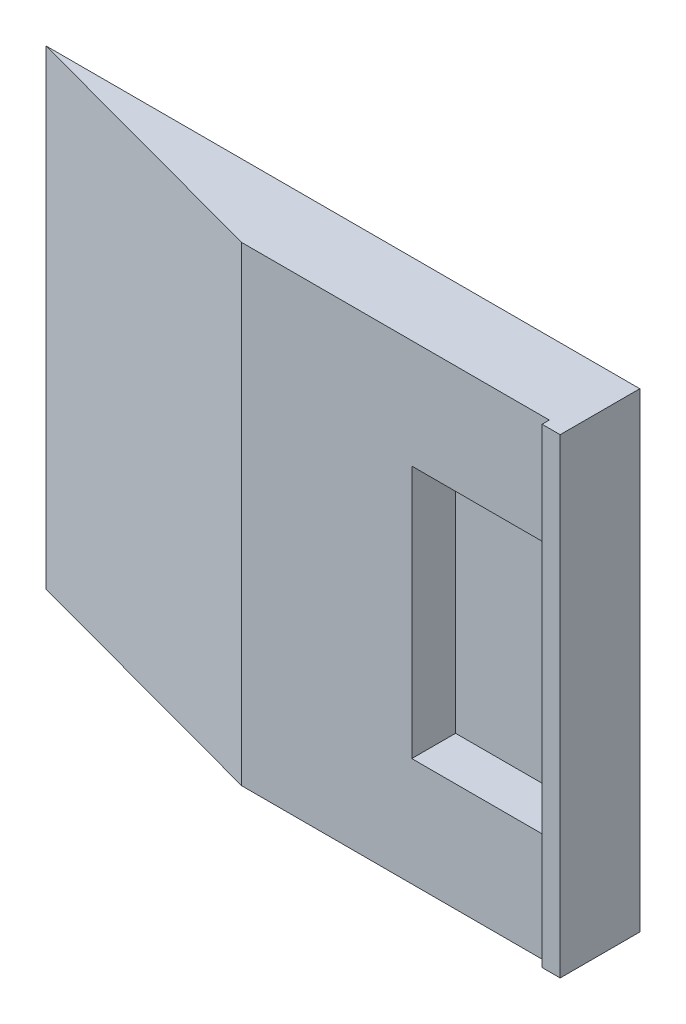
from build123d import *

# Parameters (mm, degrees)
SKETCH1_W           = 190
SKETCH1_H           = 150
BOSS_EXTRUDE1_DEPTH = 60.5
SKETCH3_W           = 60.5
SKETCH3_H           = 150
BOSS_EXTRUDE2_DEPTH = 25
SKETCH4_W           = 450
SKETCH4_H           = 650
BOSS_EXTRUDE3_DEPTH = 39.5
BOSS_EXTRUDE4_DEPTH = 650


with BuildPart() as part:
    # Sketch1 → Boss-Extrude1 (new body)
    with BuildSketch(Plane.XY):
        with Locations((0, 250)):
            Rectangle(SKETCH1_W, SKETCH1_H)
        Polygon((-95, -175), (-95, 175), (-95, 325), (-330, 325), (-330, -325), (95, -325), (95, -175), align=None)
    extrude(amount=BOSS_EXTRUDE1_DEPTH)

    # Sketch3 → Boss-Extrude2 (add)
    with BuildSketch(Plane(origin=(95, 0, 0), x_dir=(0, 0, -1), z_dir=(1, 0, 0))):
        Polygon((-70.5, -325), (0, -325), (0, 175), (-60.5, 175), (-60.5, 325), (-70.5, 325), align=None)
        with Locations((-30.25, 250)):
            Rectangle(SKETCH3_W, SKETCH3_H)
    extrude(amount=BOSS_EXTRUDE2_DEPTH)

    # Sketch4 → Boss-Extrude3 (add)
    with BuildSketch(Plane(origin=(0, 0, 0), x_dir=(-1, 0, 0), z_dir=(0, 0, -1))):
        with Locations((105, 0)):
            Rectangle(SKETCH4_W, SKETCH4_H)
    extrude(amount=BOSS_EXTRUDE3_DEPTH)

    # Sketch8 → Boss-Extrude4 (add)
    with BuildSketch(Plane(origin=(0, 325, 0), x_dir=(1, 0, 0), z_dir=(0, 1, 0))):
        Polygon((-330, -60.5), (-700, 39.5), (-330, 39.5), align=None)
    extrude(amount=-BOSS_EXTRUDE4_DEPTH)


solid = part.part
